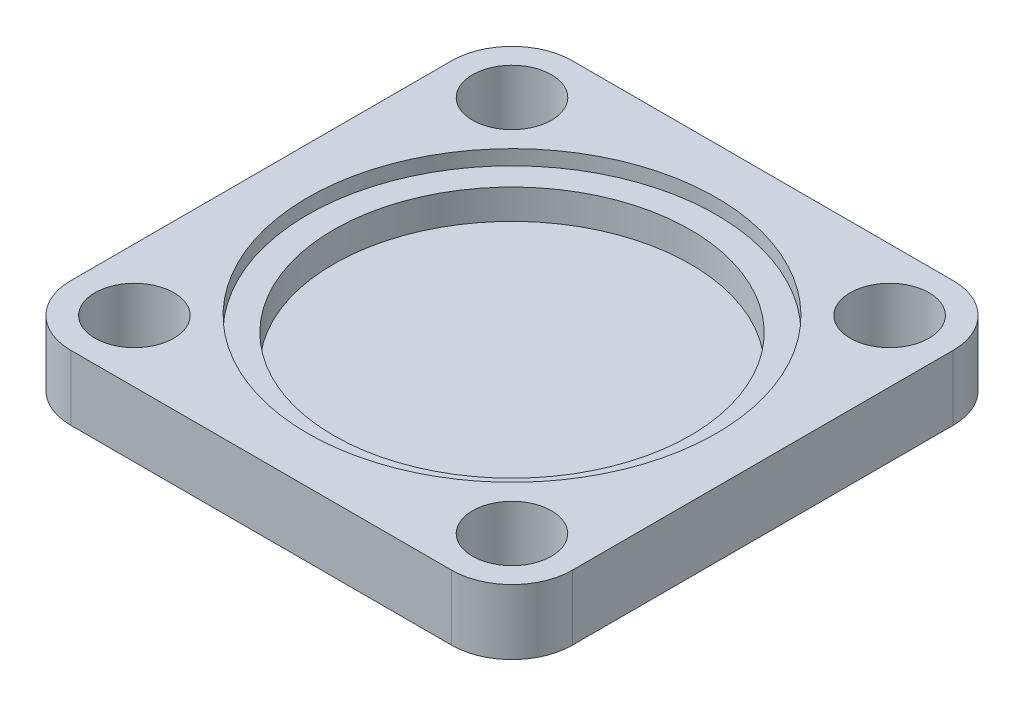
from build123d import *

# Parameters (mm, degrees)
SKETCH1_W           = 54
SKETCH1_H           = 54
SKETCH1_R           = 4.25
BOSS_EXTRUDE1_DEPTH = 7
FILLET2_R           = 6.5
SKETCH2_R           = 22
CUT_EXTRUDE1_DEPTH  = 1.6
SKETCH3_R           = 19.2
CUT_EXTRUDE2_DEPTH  = 3.2


with BuildPart() as part:
    # Sketch1 → Boss-Extrude1 (new body)
    with BuildSketch(Plane(origin=(0, 0, 0), x_dir=(1, 0, 0), z_dir=(0, 1, 0))):
        Rectangle(SKETCH1_W, SKETCH1_H)
        with Locations(Location((-20.329319959, 20.329319959, 0), (0, 0, 270))):
            Circle(SKETCH1_R, mode=Mode.SUBTRACT)
        with Locations(Location((20.329319959, -20.329319959, 0), (0, 0, 90))):
            Circle(SKETCH1_R, mode=Mode.SUBTRACT)
        with Locations(Location((-20.329319959, -20.329319959, 0), (0, 0, 270))):
            Circle(SKETCH1_R, mode=Mode.SUBTRACT)
        with Locations(Location((20.329319959, 20.329319959, 0), (0, 0, 90))):
            Circle(SKETCH1_R, mode=Mode.SUBTRACT)
    extrude(amount=BOSS_EXTRUDE1_DEPTH)

    # Fillet2
    fillet2_edges = [part.edges().sort_by_distance(p)[0] for p in [
        (27, 3.5, 27),
        (-27, 3.5, 27),
        (-27, 3.5, -27),
        (27, 3.5, -27),
    ]]
    fillet(fillet2_edges, radius=FILLET2_R)

    # Sketch2 → Cut-Extrude1 (cut)
    with BuildSketch(Plane(origin=(0, 7, 0), x_dir=(1, 0, 0), z_dir=(0, 1, 0))):
        with Locations(Location((0, 0, 0), (0, 0, 270))):
            Circle(SKETCH2_R)
    extrude(amount=-CUT_EXTRUDE1_DEPTH, mode=Mode.SUBTRACT)

    # Sketch3 → Cut-Extrude2 (cut)
    with BuildSketch(Plane(origin=(0, 5.4, 0), x_dir=(1, 0, 0), z_dir=(0, 1, 0))):
        with Locations(Location((0, 0, 0), (0, 0, 270))):
            Circle(SKETCH3_R)
    extrude(amount=-CUT_EXTRUDE2_DEPTH, mode=Mode.SUBTRACT)


solid = part.part
